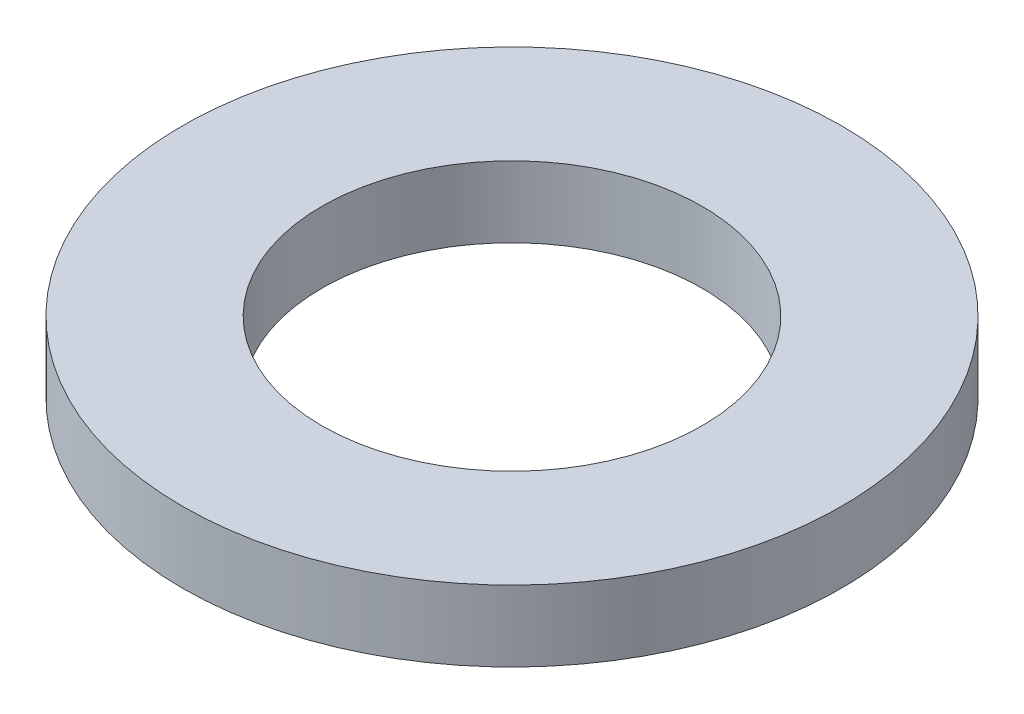
from build123d import *

# Parameters (mm, degrees)
SKETCH1_R           = 8.255
BOSS_EXTRUDE1_DEPTH = 1.778
SKETCH2_R           = 4.7625
CUT_EXTRUDE1_DEPTH  = 1.778


with BuildPart() as part:
    # Sketch1 → Boss-Extrude1 (new body)
    with BuildSketch(Plane(origin=(0, 0, 0), x_dir=(1, 0, 0), z_dir=(0, 1, 0))):
        with Locations(Location((0, 0, 0), (0, 0, 270))):
            Circle(SKETCH1_R)
    extrude(amount=BOSS_EXTRUDE1_DEPTH)

    # Sketch2 → Cut-Extrude1 (cut)
    with BuildSketch(Plane(origin=(0, 1.778, 0), x_dir=(1, 0, 0), z_dir=(0, 1, 0))):
        with Locations(Location((0, 0, 0), (0, 0, 270))):
            Circle(SKETCH2_R)
    extrude(amount=-CUT_EXTRUDE1_DEPTH, mode=Mode.SUBTRACT)


solid = part.part
